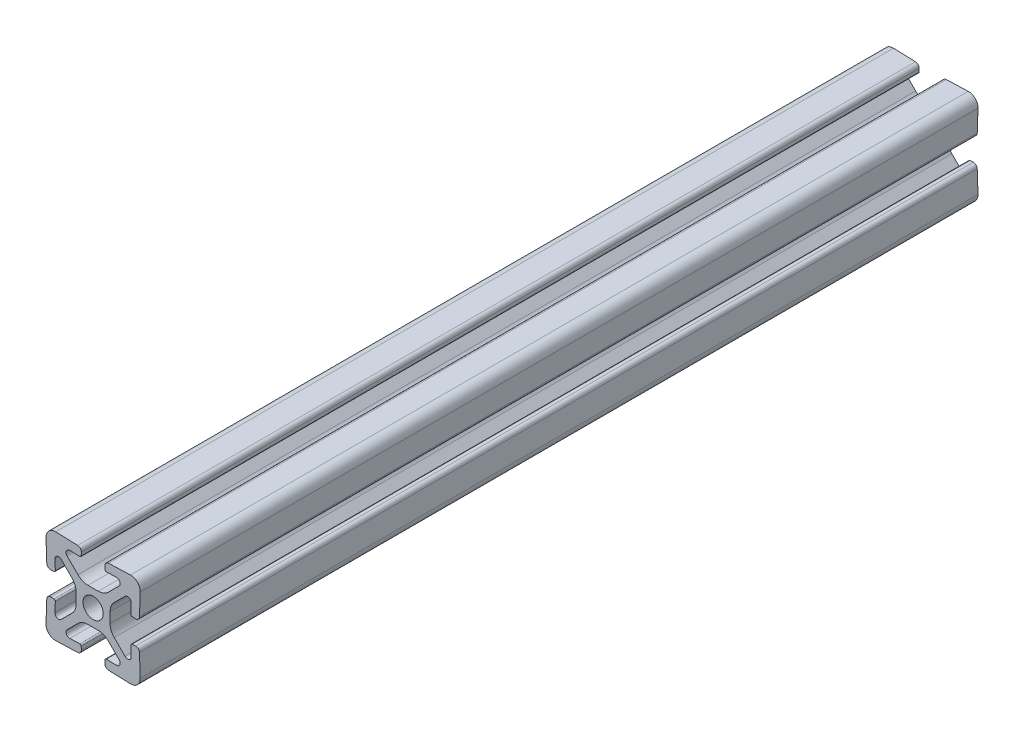
from build123d import *

# Parameters (mm, degrees)
BOSS_EXTRUDE1_DEPTH = 88.9
CIRPATTERN1_COUNT   = 4


with BuildPart() as part:
    # Sketch3 → Boss-Extrude1 (new, symmetric)
    with BuildSketch(Plane.XY):
        with BuildLine():
            Line((-2.524916986, 8.30911066), (-2.500487338, 9.008684239))
            ThreePointArc((-2.500487338, 9.008684239), (-2.714917039, 9.582202525), (-3.272080403, 9.836116498))
            Line((-3.272080403, 9.836116498), (-7.930201007, 9.998781654))
            ThreePointArc((-7.930201007, 9.998781654), (-9.414213562, 9.414213562), (-9.998781654, 7.930201007))
            Line((-9.998781654, 7.930201007), (-9.836116498, 3.272080403))
            ThreePointArc((-9.836116498, 3.272080403), (-9.582202525, 2.714917039), (-9.008684239, 2.500487338))
            Line((-9.008684239, 2.500487338), (-8.30911066, 2.524916986))
            ThreePointArc((-8.30911066, 2.524916986), (-8.100174399, 2.620134726), (-8.019763261, 2.835204083))
            Line((-8.019763261, 2.835204083), (-8.093719461, 4.953032548))
            ThreePointArc((-8.093719461, 4.953032548), (-7.631170264, 5.686128657), (-6.779559917, 5.52444538))
            Line((-6.779559917, 5.52444538), (-4.478679656, 3.22356512))
            ThreePointArc((-4.478679656, 3.22356512), (-3.828361402, 2.250295073), (-3.6, 1.102244776))
            Line((-3.6, 1.102244776), (-3.6, 0))
            Line((-3.6, 0), (-2.15, 0))
            ThreePointArc((-2.15, 0), (-1.52027958, 1.52027958), (0, 2.15))
            Line((0, 2.15), (0, 3.6))
            Line((0, 3.6), (-1.102244776, 3.6))
            ThreePointArc((-1.102244776, 3.6), (-2.250295073, 3.828361402), (-3.22356512, 4.478679656))
            Line((-3.22356512, 4.478679656), (-5.52444538, 6.779559917))
            ThreePointArc((-5.52444538, 6.779559917), (-5.686128657, 7.631170264), (-4.953032548, 8.093719461))
            Line((-4.953032548, 8.093719461), (-2.835204083, 8.019763261))
            ThreePointArc((-2.835204083, 8.019763261), (-2.620134726, 8.100174399), (-2.524916986, 8.30911066))
        make_face()
    boss_extrude1 = extrude(amount=BOSS_EXTRUDE1_DEPTH, both=True)

    # CirPattern1: Boss-Extrude1 ×4 about axis
    cirpattern1_axis = Axis((0, 0, 0), (0, 0, 1))
    for i in range(1, CIRPATTERN1_COUNT):
        add(boss_extrude1.rotate(cirpattern1_axis, i * 360 / CIRPATTERN1_COUNT))


solid = part.part
